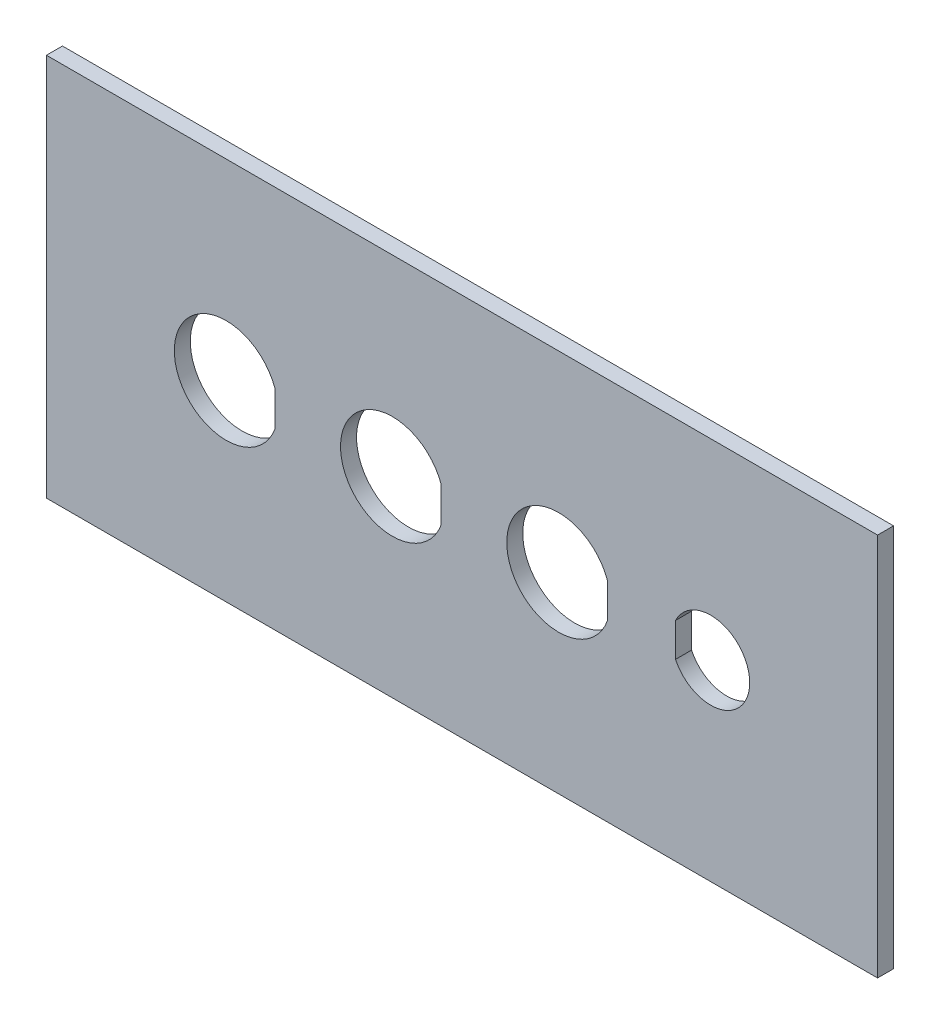
from build123d import *

# Parameters (mm, degrees)
SKETCH1_W           = 165.1
SKETCH1_H           = 76.2
BOSS_EXTRUDE1_DEPTH = 3.175


with BuildPart() as part:
    # Sketch1 → Boss-Extrude1 (new body)
    with BuildSketch(Plane.XY):
        with Locations((9.351172696, -0.493343457)):
            Rectangle(SKETCH1_W, SKETCH1_H)
        with BuildLine():
            Line((51.769172696, 2.857146657), (51.769172696, -3.84383357))
            ThreePointArc((51.769172696, -3.84383357), (66.501172696, -0.493343457), (51.769172696, 2.857146657))
        make_face(mode=Mode.SUBTRACT)
        with BuildLine():
            Line((-27.798827304, 2.970758158), (-27.798827304, -3.957445072))
            ThreePointArc((-27.798827304, -3.957445072), (-47.798827304, -0.493343457), (-27.798827304, 2.970758158))
        make_face(mode=Mode.SUBTRACT)
        with BuildLine():
            Line((5.221172696, 2.970758158), (5.221172696, -3.957445072))
            ThreePointArc((5.221172696, -3.957445072), (-14.778827304, -0.493343457), (5.221172696, 2.970758158))
        make_face(mode=Mode.SUBTRACT)
        with BuildLine():
            Line((38.241172696, 2.970758158), (38.241172696, -3.957445072))
            ThreePointArc((38.241172696, -3.957445072), (18.241172696, -0.493343457), (38.241172696, 2.970758158))
        make_face(mode=Mode.SUBTRACT)
    extrude(amount=BOSS_EXTRUDE1_DEPTH)


solid = part.part
